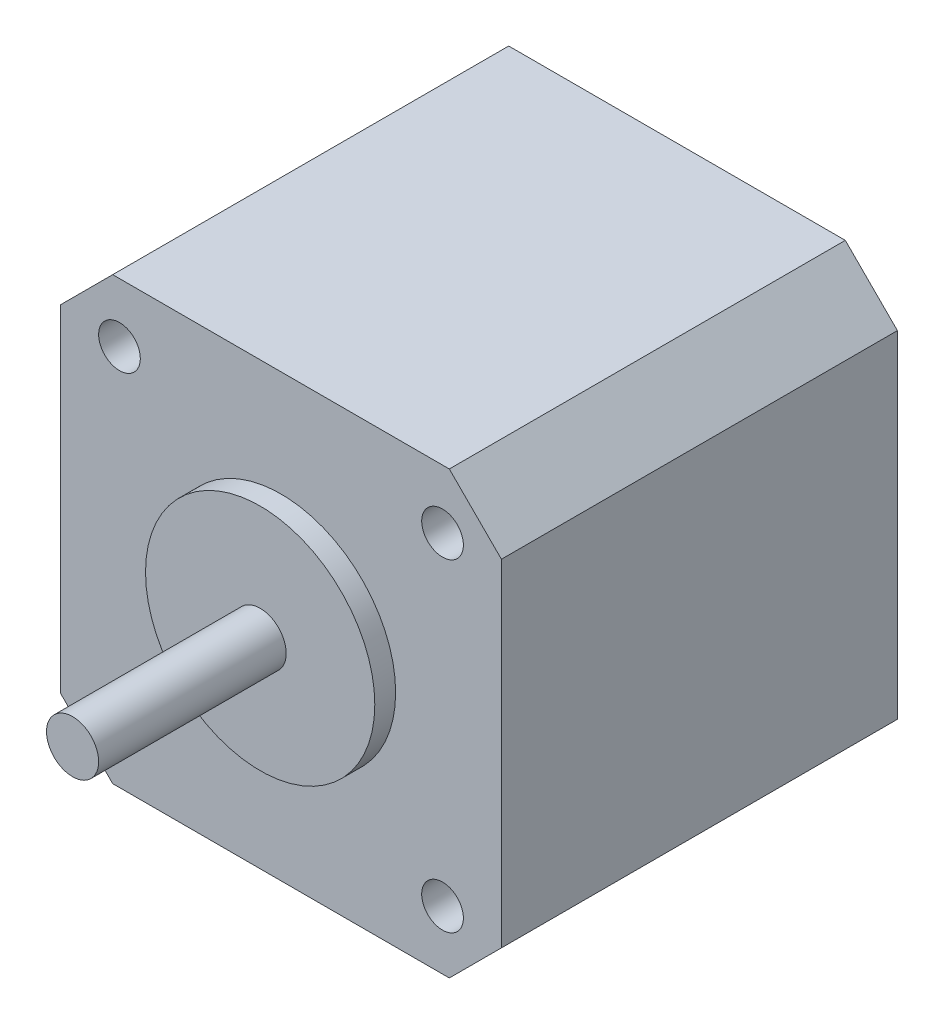
from build123d import *

# Parameters (mm, degrees)
IZIM1_W                     = 42.3
IZIM1_H                     = 42.3
Y_KSEKLIK_EKSTR_ZYON1_DEPTH = 38
PAH1_SIZE                   = 5
IZIM2_R                     = 2
KES_EKSTR_ZYON1_DEPTH       = 5
IZIM3_R                     = 11
Y_KSEKLIK_EKSTR_ZYON2_DEPTH = 2
IZIM4_R                     = 2.5
Y_KSEKLIK_EKSTR_ZYON3_DEPTH = 18


with BuildPart() as part:
    # Çizim1 → Yükseklik-Ekstrüzyon1 (new body)
    with BuildSketch(Plane.XY):
        Rectangle(IZIM1_W, IZIM1_H)
    extrude(amount=Y_KSEKLIK_EKSTR_ZYON1_DEPTH)

    # Pah1
    pah1_edges = [part.edges().sort_by_distance(p)[0] for p in [
        (21.15, -21.15, 19),
        (-21.15, -21.15, 19),
        (-21.15, 21.15, 19),
        (21.15, 21.15, 19),
    ]]
    chamfer(pah1_edges, length=PAH1_SIZE)

    # Çizim2 → Kes-Ekstrüzyon1 (cut)
    with BuildSketch(Plane.XY.offset(38)):
        with Locations((-15.5, 15.5)):
            Circle(IZIM2_R)
        with Locations((15.5, 15.5)):
            Circle(IZIM2_R)
        with Locations((-15.5, -15.5)):
            Circle(IZIM2_R)
        with Locations((15.5, -15.5)):
            Circle(IZIM2_R)
    extrude(amount=-KES_EKSTR_ZYON1_DEPTH, mode=Mode.SUBTRACT)

    # Çizim3 → Yükseklik-Ekstrüzyon2 (add)
    with BuildSketch(Plane.XY.offset(38)):
        Circle(IZIM3_R)
    extrude(amount=Y_KSEKLIK_EKSTR_ZYON2_DEPTH)

    # Çizim4 → Yükseklik-Ekstrüzyon3 (add)
    with BuildSketch(Plane.XY.offset(40)):
        Circle(IZIM4_R)
    extrude(amount=Y_KSEKLIK_EKSTR_ZYON3_DEPTH)


solid = part.part
